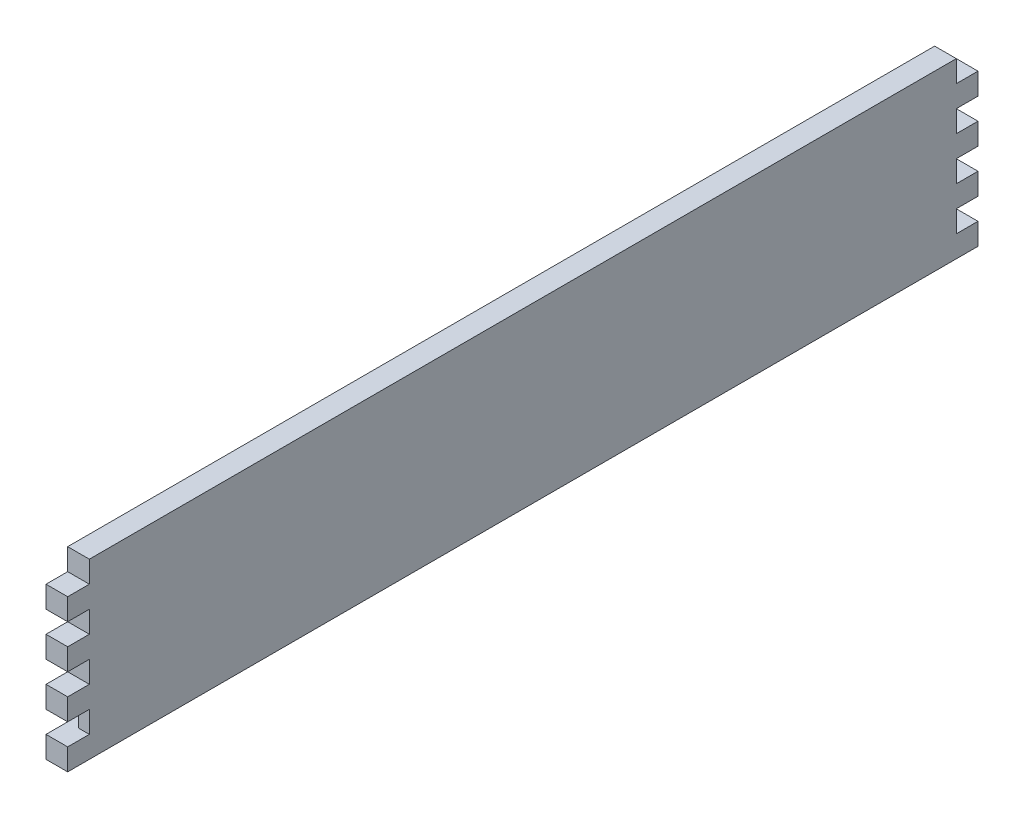
from build123d import *

# Parameters (mm, degrees)
BOSS_EXTRUDE1_DEPTH = 12.7
SKETCH2_W           = 557.099300044
SKETCH2_H           = 6.35
CUT_EXTRUDE1_DEPTH  = 6.35


with BuildPart() as part:
    # Sketch1 → Boss-Extrude1 (new body)
    with BuildSketch(Plane(origin=(0, 0, 0), x_dir=(0, 0, -1), z_dir=(1, 0, 0))):
        Polygon((520.7, 25.4), (533.4, 25.4), (533.4, 38.1), (520.7, 38.1), (520.7, 50.8), (533.4, 50.8), (533.4, 63.5), (520.7, 63.5), (520.7, 76.2), (533.4, 76.2), (533.4, 88.9), (520.7, 88.9), (520.7, 101.6), (12.7, 101.6), (12.7, 88.9), (0, 88.9), (0, 76.2), (12.7, 76.2), (12.7, 63.5), (0, 63.5), (0, 50.8), (12.7, 50.8), (12.7, 38.1), (0, 38.1), (0, 25.4), (12.7, 25.4), (12.7, 12.7), (0, 12.7), (0, 0), (533.4, 0), (533.4, 12.7), (520.7, 12.7), align=None)
    extrude(amount=BOSS_EXTRUDE1_DEPTH)

    # Sketch2 → Cut-Extrude1 (cut)
    with BuildSketch(Plane(origin=(0, 0, 0), x_dir=(0, 0, -1), z_dir=(1, 0, 0))):
        with Locations((263.077138041, 15.875)):
            Rectangle(SKETCH2_W, SKETCH2_H)
    extrude(amount=CUT_EXTRUDE1_DEPTH, mode=Mode.SUBTRACT)


solid = part.part
